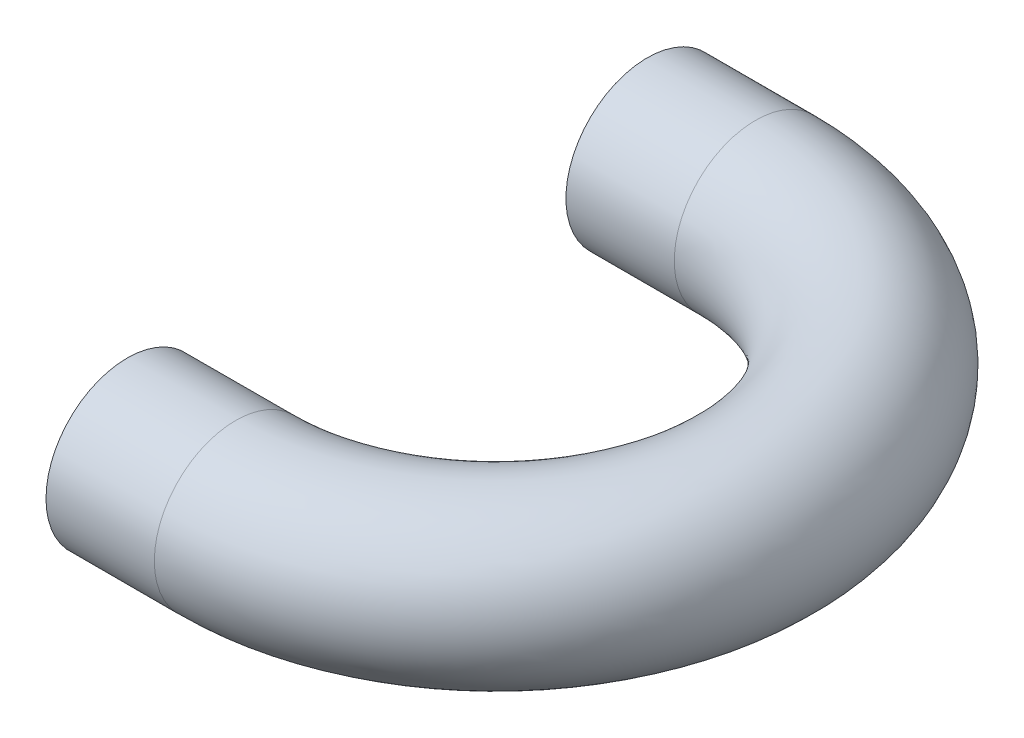
from build123d import *

# Parameters (mm, degrees)
SKETCH1_R             = 4.7625
SKETCH1_R_2           = 3.175
BOSS_EXTRUDE1_DEPTH   = 6.35
BOSS_EXTRUDE1_2_DEPTH = 6.35
SKETCH2_R             = 4.7625
SKETCH2_R_2           = 3.175
REVOLVE1_ANGLE        = 180


with BuildPart() as part:
    # Sketch1 → Boss-Extrude1 (new body)
    with BuildSketch(Plane(origin=(0, 0, 0), x_dir=(0, 0, -1), z_dir=(1, 0, 0))):
        Circle(SKETCH1_R)
        Circle(SKETCH1_R_2, mode=Mode.SUBTRACT)
    extrude(amount=BOSS_EXTRUDE1_DEPTH)



with BuildPart() as body_2:
    # Sketch1 → Boss-Extrude1 2 (new body)
    with BuildSketch(Plane(origin=(0, 0, 0), x_dir=(0, 0, -1), z_dir=(1, 0, 0))):
        with Locations((30.48, 0)):
            Circle(SKETCH1_R)
        with Locations((30.48, 0)):
            Circle(SKETCH1_R_2, mode=Mode.SUBTRACT)
    extrude(amount=BOSS_EXTRUDE1_2_DEPTH)


with BuildPart() as part_1:
    add(part.part)

    add(body_2.part)  # Revolve1 merges body 2
    # Sketch2 → Revolve1 (revolve)
    with BuildSketch(Plane(origin=(6.35, 0, 0), x_dir=(0, 0, -1), z_dir=(1, 0, 0))):
        with Locations(Location((0, 0, 0), (0, 0, 180))):
            Circle(SKETCH2_R)
        with Locations(Location((0, 0, 0), (0, 0, 180))):
            Circle(SKETCH2_R_2, mode=Mode.SUBTRACT)
    revolve(axis=Axis((6.35, 0, -15.24), (0, 1, 0)), revolution_arc=REVOLVE1_ANGLE)


solid = part_1.part
